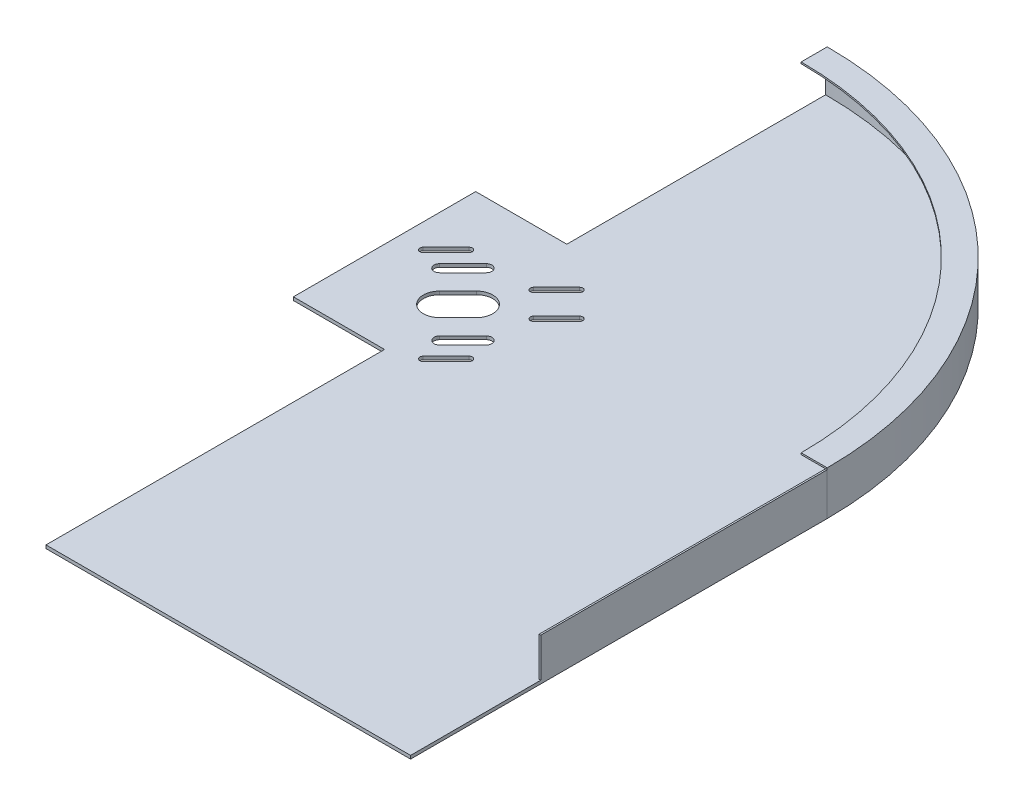
from build123d import *

# Parameters (mm, degrees)
BOSS_EXTRUDE1_DEPTH  = 3.175
BOSS_EXTRUDE2_DEPTH  = 38.1
SKETCH4_W            = 1.5875
SKETCH4_H            = 279.4
BOSS_EXTRUDE3_DEPTH  = 38.1
SKETCH6_R            = 1.5875
CUT_EXTRUDE1_DEPTH   = 19.05
SKETCH10_W           = 101.6
SKETCH10_H           = 3.175
BOSS_EXTRUDE5_DEPTH  = 63.5
SKETCH12_W           = 355.6
SKETCH12_H           = 101.6
BOSS_EXTRUDE6_DEPTH  = 3.175
SKETCH13_W           = 63.5
SKETCH13_H           = 63.5
SKETCH13_H_2         = 12.7
BOSS_EXTRUDE7_DEPTH  = 3.175
CUT_EXTRUDE3_DEPTH   = 38.1
BOSS_EXTRUDE10_DEPTH = 1.5875
CUT_EXTRUDE5_DEPTH   = 3.175
SKETCH22_W           = 25.4
SKETCH22_H           = 177.8
BOSS_EXTRUDE11_DEPTH = 3.175
CUT_EXTRUDE6_DEPTH   = 33.02


with BuildPart() as part:
    # Sketch2 → Boss-Extrude1 (new body)
    with BuildSketch(Plane(origin=(0, 0, 0), x_dir=(1, 0, 0), z_dir=(0, 1, 0))):
        with BuildLine():
            Line((0, 355.6), (0, 0))
            Line((0, 0), (0, -304.8))
            Line((0, -304.8), (355.6, -304.8))
            Line((355.6, -304.8), (355.6, 0))
            ThreePointArc((355.6, 0), (251.44717139, 251.44717139), (0, 355.6))
        make_face()
    extrude(amount=BOSS_EXTRUDE1_DEPTH)

    # Sketch3 → Boss-Extrude2 (add)
    with BuildSketch(Plane(origin=(0, 3.175, 0), x_dir=(1, 0, 0), z_dir=(0, 1, 0))):
        with BuildLine():
            Line((0, 355.6), (0, 354.0125))
            ThreePointArc((0, 354.0125), (250.324639375, 250.324639375), (354.0125, 0))
            Line((354.0125, 0), (355.6, 0))
            ThreePointArc((355.6, 0), (251.44717139, 251.44717139), (0, 355.6))
        make_face()
    extrude(amount=BOSS_EXTRUDE2_DEPTH)

    # Sketch4 → Boss-Extrude3 (add)
    with BuildSketch(Plane(origin=(0, 3.175, 0), x_dir=(1, 0, 0), z_dir=(0, 1, 0))):
        with Locations((354.80625, -139.7)):
            Rectangle(SKETCH4_W, SKETCH4_H)
    extrude(amount=BOSS_EXTRUDE3_DEPTH)

    # Sketch6 → Cut-Extrude1 (cut)
    with BuildSketch(Plane(origin=(0, 3.175, 0), x_dir=(1, 0, 0), z_dir=(0, 1, 0))):
        Circle(SKETCH6_R)
    extrude(amount=-CUT_EXTRUDE1_DEPTH, mode=Mode.SUBTRACT)

    # Sketch10 → Boss-Extrude5 (add)
    with BuildSketch(Plane.ZY):
        with Locations((12.7, 1.5875)):
            Rectangle(SKETCH10_W, SKETCH10_H)
    extrude(amount=BOSS_EXTRUDE5_DEPTH)

    # Sketch12 → Boss-Extrude6 (add)
    with BuildSketch(Plane.XZ):
        with Locations((177.8, 355.6)):
            Rectangle(SKETCH12_W, SKETCH12_H)
    extrude(amount=-BOSS_EXTRUDE6_DEPTH)

    # Sketch13 → Boss-Extrude7 (add)
    with BuildSketch(Plane(origin=(0, 3.175, 0), x_dir=(1, 0, 0), z_dir=(0, 1, 0))):
        with Locations((-31.75, 69.85)):
            Rectangle(SKETCH13_W, SKETCH13_H)
        with Locations((-31.75, -69.85)):
            Rectangle(SKETCH13_W, SKETCH13_H_2)
    extrude(amount=-BOSS_EXTRUDE7_DEPTH)

    # Sketch11 → Cut-Extrude3 (cut)
    with BuildSketch(Plane(origin=(0, 3.175, 0), x_dir=(1, 0, 0), z_dir=(0, 1, 0))):
        with BuildLine():
            Line((-22.450640303, 0), (-4.490128061, 17.960512242))
            ThreePointArc((-4.490128061, 17.960512242), (17.960512242, 17.960512242), (17.960512242, -4.490128061))
            Line((17.960512242, -4.490128061), (0, -22.450640303))
            ThreePointArc((0, -22.450640303), (-22.450640303, -22.450640303), (-22.450640303, 0))
        make_face()
    extrude(amount=-CUT_EXTRUDE3_DEPTH, mode=Mode.SUBTRACT)

    # Sketch18 → Boss-Extrude10 (add)
    with BuildSketch(Plane(origin=(0, 41.275, 0), x_dir=(1, 0, 0), z_dir=(0, 1, 0))):
        with BuildLine():
            Line((0, 355.6), (0, 330.2))
            ThreePointArc((0, 330.2), (233.486659148, 233.486659148), (330.2, 0))
            Line((330.2, 0), (355.6, 0))
            ThreePointArc((355.6, 0), (251.44717139, 251.44717139), (0, 355.6))
        make_face()
    extrude(amount=BOSS_EXTRUDE10_DEPTH)

    # Sketch19 → Cut-Extrude5 (cut)
    with BuildSketch(Plane(origin=(44.866081356, 3.175, 35.384906035), x_dir=(-0.707106781186549, 0, -0.7071067811865461), z_dir=(0, 1, 0))):
        with BuildLine():
            Line((19.004203404, 22.579203363), (19.004203404, -9.566550011))
            ThreePointArc((19.004203404, -9.566550011), (13.566017381, -15.004736034), (8.127831358, -9.566550011))
            Line((8.127831358, -9.566550011), (8.127831358, 22.579203363))
            ThreePointArc((8.127831358, 22.579203363), (13.566017381, 28.017389386), (19.004203404, 22.579203363))
        make_face()
        with BuildLine():
            Line((94.473450284, 22.579203363), (94.473450284, -9.566550011))
            ThreePointArc((94.473450284, -9.566550011), (99.926017381, -15.019117108), (105.378584479, -9.566550011))
            Line((105.378584479, -9.566550011), (105.378584479, 22.579203363))
            ThreePointArc((105.378584479, 22.579203363), (99.926017381, 28.03177046), (94.473450284, 22.579203363))
        make_face()
    extrude(amount=-CUT_EXTRUDE5_DEPTH, mode=Mode.SUBTRACT)

    # Sketch22 → Boss-Extrude11 (add)
    with BuildSketch(Plane.XZ):
        with Locations((-76.2, -12.7)):
            Rectangle(SKETCH22_W, SKETCH22_H)
    extrude(amount=-BOSS_EXTRUDE11_DEPTH)

    # Sketch20 → Cut-Extrude6 (cut)
    with BuildSketch(Plane(origin=(269.3998556, -22.225, -80.446532344), x_dir=(1, 0, 0), z_dir=(0, 1, 0))):
        with BuildLine():
            Line((-336.976282911, -51.485206353), (-314.525642608, -29.034566051))
            ThreePointArc((-314.525642608, -29.034566051), (-310.035514547, -29.034566051), (-310.035514547, -33.524694111))
            Line((-310.035514547, -33.524694111), (-332.48615485, -55.975334414))
            ThreePointArc((-332.48615485, -55.975334414), (-336.976282911, -55.975334414), (-336.976282911, -51.485206353))
        make_face()
        with BuildLine():
            Line((-240.438529609, -148.022959655), (-217.987889306, -125.572319352))
            ThreePointArc((-217.987889306, -125.572319352), (-217.987889306, -121.082191292), (-222.478017367, -121.082191292))
            Line((-222.478017367, -121.082191292), (-244.92865767, -143.532831594))
            ThreePointArc((-244.92865767, -143.532831594), (-244.92865767, -148.022959655), (-240.438529609, -148.022959655))
        make_face()
        with BuildLine():
            Line((-249.280873656, -31.417542155), (-226.830233353, -8.966901852))
            ThreePointArc((-226.830233353, -8.966901852), (-222.340105293, -8.966901852), (-222.340105293, -13.457029913))
            Line((-222.340105293, -13.457029913), (-244.790745596, -35.907670216))
            ThreePointArc((-244.790745596, -35.907670216), (-249.280873656, -35.907670216), (-249.280873656, -31.417542155))
        make_face()
        with BuildLine():
            Line((-220.370865411, -60.3275504), (-197.920225108, -37.876910098))
            ThreePointArc((-197.920225108, -37.876910098), (-197.920225108, -33.386782037), (-202.410353169, -33.386782037))
            Line((-202.410353169, -33.386782037), (-224.860993471, -55.83742234))
            ThreePointArc((-224.860993471, -55.83742234), (-224.860993471, -60.3275504), (-220.370865411, -60.3275504))
        make_face()
    extrude(amount=CUT_EXTRUDE6_DEPTH, mode=Mode.SUBTRACT)


solid = part.part
